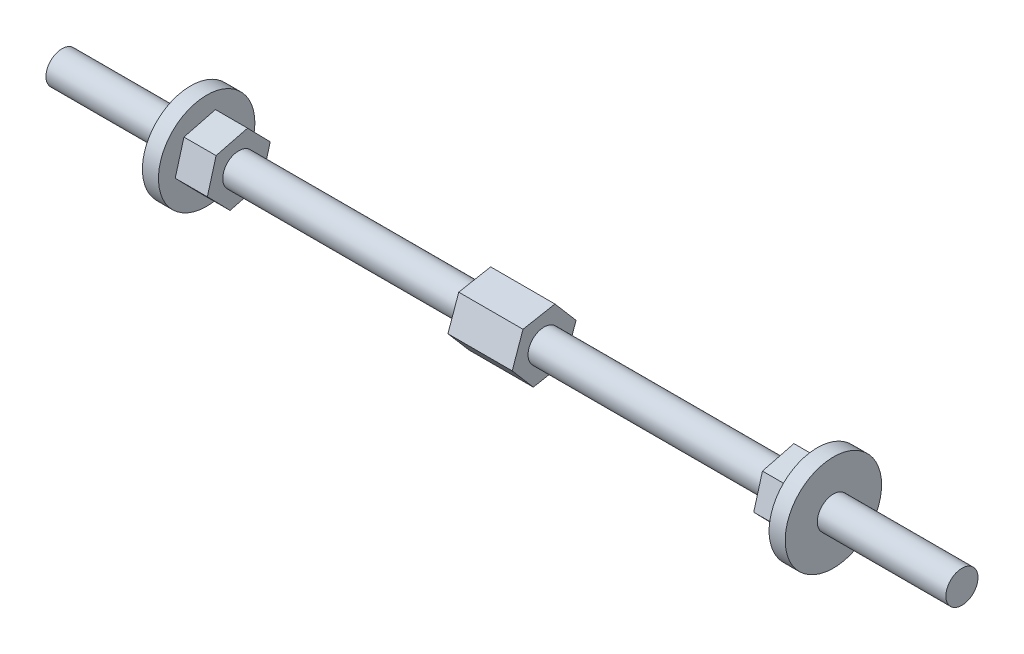
from build123d import *

# Parameters (mm, degrees)
BOSS_EXTRUDE1_DEPTH      = 6.35
BOSS_EXTRUDE1_DEPTH_BACK = 6.35
BOSS_EXTRUDE2_DEPTH      = 47.625
BOSS_EXTRUDE2_DEPTH_BACK = 60.325
SKETCH3_R                = 3.175
BOSS_EXTRUDE3_DEPTH      = 6.35
SKETCH5_R                = 9.525
BOSS_EXTRUDE4_DEPTH      = 3.175
SKETCH7_R                = 3.175
BOSS_EXTRUDE5_DEPTH      = 25.4


with BuildPart() as part:
    # Sketch2 → Boss-Extrude1 (new, two sides: drawn at the far end of the back side and taken through both)
    with BuildSketch(Plane(origin=(0, 0, 0), x_dir=(0, 0, -1), z_dir=(1, 0, 0)).offset(-BOSS_EXTRUDE1_DEPTH_BACK)):
        Polygon((4.171210262, -4.874787896), (6.307295287, 1.174980103), (2.136085025, 6.049767999), (-4.171210262, 4.874787896), (-6.307295287, -1.174980103), (-2.136085025, -6.049767999), align=None)
    extrude(amount=BOSS_EXTRUDE1_DEPTH + BOSS_EXTRUDE1_DEPTH_BACK)

    # Sketch3 → Boss-Extrude2 (add, two sides: drawn at the far end of the back side and taken through both)
    with BuildSketch(Plane(origin=(6.35, 0, 0), x_dir=(0, 0, -1), z_dir=(1, 0, 0)).offset(-BOSS_EXTRUDE2_DEPTH_BACK)):
        Circle(SKETCH3_R)
    extrude(amount=BOSS_EXTRUDE2_DEPTH + BOSS_EXTRUDE2_DEPTH_BACK)

    # Sketch4 → Boss-Extrude3 (add)
    with BuildSketch(Plane(origin=(53.975, 0, 0), x_dir=(0, 0, -1), z_dir=(1, 0, 0))):
        Polygon((4.488142835, -4.584662035), (6.214505208, 1.594514693), (1.726362373, 6.179176728), (-4.488142835, 4.584662035), (-6.214505208, -1.594514693), (-1.726362373, -6.179176728), align=None)
    boss_extrude3 = extrude(amount=BOSS_EXTRUDE3_DEPTH)

    # Sketch5 → Boss-Extrude4 (add)
    with BuildSketch(Plane(origin=(60.325, 0, 0), x_dir=(0, 0, -1), z_dir=(1, 0, 0))):
        Circle(SKETCH5_R)
    boss_extrude4 = extrude(amount=BOSS_EXTRUDE4_DEPTH)

    # Mirror1: Boss-Extrude3, Boss-Extrude4 across plane
    add(boss_extrude3.mirror(Plane(origin=(0, 0, 0), x_dir=(0, 0, 1), z_dir=(1, 0, 0))))
    add(boss_extrude4.mirror(Plane(origin=(0, 0, 0), x_dir=(0, 0, 1), z_dir=(1, 0, 0))))

    # Sketch7 → Boss-Extrude5 (add)
    with BuildSketch(Plane(origin=(63.5, 0, 0), x_dir=(0, 0, -1), z_dir=(1, 0, 0))):
        Circle(SKETCH7_R)
    boss_extrude5 = extrude(amount=BOSS_EXTRUDE5_DEPTH)

    # Mirror3: Boss-Extrude5 across plane
    add(boss_extrude5.mirror(Plane(origin=(0, 0, 0), x_dir=(0, 0, 1), z_dir=(1, 0, 0))))


solid = part.part
